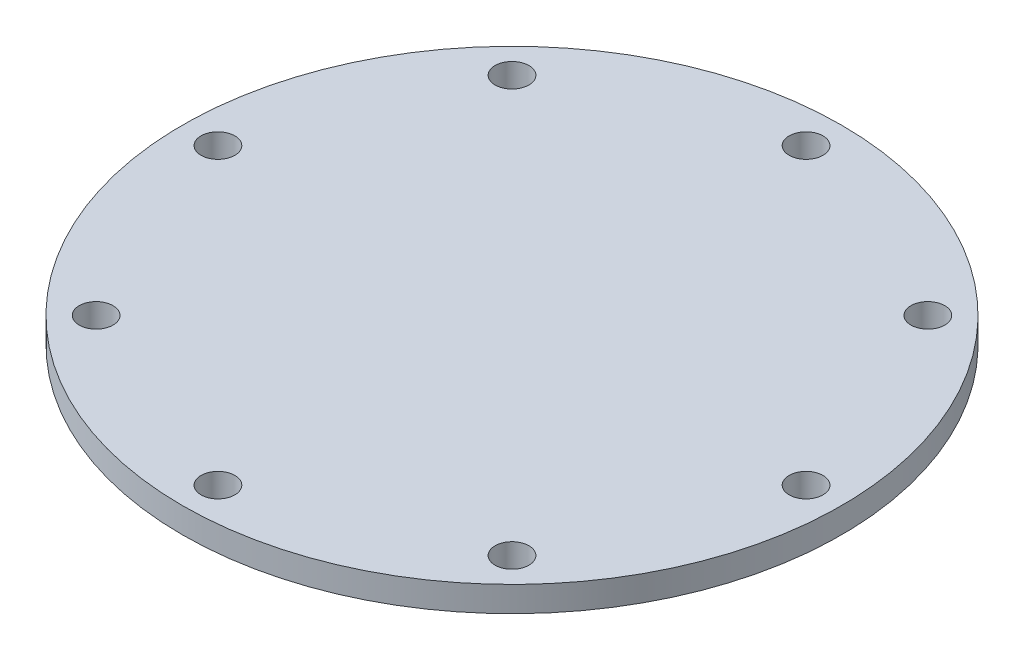
from build123d import *

# Parameters (mm, degrees)
SKETCH_1_R          = 195
EXTRUDE_1_DEPTH     = 15
CUT_EXTRUDE_1_REACH = 278.179
SKETCH_2_R          = 10


with BuildPart() as part:
    # 草图1 → 凸台-拉伸1 (new body)
    with BuildSketch(Plane(origin=(0, 0, 0), x_dir=(1, 0, 0), z_dir=(0, 1, 0))):
        with Locations(Location((0, 0, 0), (0, 0, 270))):
            Circle(SKETCH_1_R)
    extrude(amount=EXTRUDE_1_DEPTH)

    # 草图2 → 切除-拉伸1 (cut, up to next)
    with BuildSketch(Plane(origin=(0, 15, 0), x_dir=(1, 0, 0), z_dir=(0, 1, 0)), mode=Mode.PRIVATE) as cut_extrude_1_sk1:
        with Locations(Location((-174, 0, 0), (0, 0, 270))):
            Circle(SKETCH_2_R)
    cut_extrude_1_tool1 = extrude(cut_extrude_1_sk1.sketch, amount=-CUT_EXTRUDE_1_REACH, mode=Mode.PRIVATE) & part.part
    # 草图2 → 切除-拉伸1 (cut, up to next)
    with BuildSketch(Plane(origin=(0, 15, 0), x_dir=(1, 0, 0), z_dir=(0, 1, 0)), mode=Mode.PRIVATE) as cut_extrude_1_sk2:
        with Locations(Location((-123.036579926, 123.036579926, 0), (0, 0, 270))):
            Circle(SKETCH_2_R)
    cut_extrude_1_tool2 = extrude(cut_extrude_1_sk2.sketch, amount=-CUT_EXTRUDE_1_REACH, mode=Mode.PRIVATE) & part.part
    # 草图2 → 切除-拉伸1 (cut, up to next)
    with BuildSketch(Plane(origin=(0, 15, 0), x_dir=(1, 0, 0), z_dir=(0, 1, 0)), mode=Mode.PRIVATE) as cut_extrude_1_sk3:
        with Locations(Location((0, 174, 0), (0, 0, 270))):
            Circle(SKETCH_2_R)
    cut_extrude_1_tool3 = extrude(cut_extrude_1_sk3.sketch, amount=-CUT_EXTRUDE_1_REACH, mode=Mode.PRIVATE) & part.part
    # 草图2 → 切除-拉伸1 (cut, up to next)
    with BuildSketch(Plane(origin=(0, 15, 0), x_dir=(1, 0, 0), z_dir=(0, 1, 0)), mode=Mode.PRIVATE) as cut_extrude_1_sk4:
        with Locations(Location((123.036579926, 123.036579926, 0), (0, 0, 270))):
            Circle(SKETCH_2_R)
    cut_extrude_1_tool4 = extrude(cut_extrude_1_sk4.sketch, amount=-CUT_EXTRUDE_1_REACH, mode=Mode.PRIVATE) & part.part
    # 草图2 → 切除-拉伸1 (cut, up to next)
    with BuildSketch(Plane(origin=(0, 15, 0), x_dir=(1, 0, 0), z_dir=(0, 1, 0)), mode=Mode.PRIVATE) as cut_extrude_1_sk5:
        with Locations(Location((174, 0, 0), (0, 0, 270))):
            Circle(SKETCH_2_R)
    cut_extrude_1_tool5 = extrude(cut_extrude_1_sk5.sketch, amount=-CUT_EXTRUDE_1_REACH, mode=Mode.PRIVATE) & part.part
    # 草图2 → 切除-拉伸1 (cut, up to next)
    with BuildSketch(Plane(origin=(0, 15, 0), x_dir=(1, 0, 0), z_dir=(0, 1, 0)), mode=Mode.PRIVATE) as cut_extrude_1_sk6:
        with Locations(Location((123.036579926, -123.036579926, 0), (0, 0, 270))):
            Circle(SKETCH_2_R)
    cut_extrude_1_tool6 = extrude(cut_extrude_1_sk6.sketch, amount=-CUT_EXTRUDE_1_REACH, mode=Mode.PRIVATE) & part.part
    # 草图2 → 切除-拉伸1 (cut, up to next)
    with BuildSketch(Plane(origin=(0, 15, 0), x_dir=(1, 0, 0), z_dir=(0, 1, 0)), mode=Mode.PRIVATE) as cut_extrude_1_sk7:
        with Locations(Location((0, -174, 0), (0, 0, 270))):
            Circle(SKETCH_2_R)
    cut_extrude_1_tool7 = extrude(cut_extrude_1_sk7.sketch, amount=-CUT_EXTRUDE_1_REACH, mode=Mode.PRIVATE) & part.part
    # 草图2 → 切除-拉伸1 (cut, up to next)
    with BuildSketch(Plane(origin=(0, 15, 0), x_dir=(1, 0, 0), z_dir=(0, 1, 0)), mode=Mode.PRIVATE) as cut_extrude_1_sk8:
        with Locations(Location((-123.036579926, -123.036579926, 0), (0, 0, 270))):
            Circle(SKETCH_2_R)
    cut_extrude_1_tool8 = extrude(cut_extrude_1_sk8.sketch, amount=-CUT_EXTRUDE_1_REACH, mode=Mode.PRIVATE) & part.part
    add(cut_extrude_1_tool1.solids().sort_by_distance((-174, 15, 0))[0], mode=Mode.SUBTRACT)
    add(cut_extrude_1_tool2.solids().sort_by_distance((-123.03658, 15, -123.03658))[0], mode=Mode.SUBTRACT)
    add(cut_extrude_1_tool3.solids().sort_by_distance((0, 15, -174))[0], mode=Mode.SUBTRACT)
    add(cut_extrude_1_tool4.solids().sort_by_distance((123.03658, 15, -123.03658))[0], mode=Mode.SUBTRACT)
    add(cut_extrude_1_tool5.solids().sort_by_distance((174, 15, 0))[0], mode=Mode.SUBTRACT)
    add(cut_extrude_1_tool6.solids().sort_by_distance((123.03658, 15, 123.03658))[0], mode=Mode.SUBTRACT)
    add(cut_extrude_1_tool7.solids().sort_by_distance((0, 15, 174))[0], mode=Mode.SUBTRACT)
    add(cut_extrude_1_tool8.solids().sort_by_distance((-123.03658, 15, 123.03658))[0], mode=Mode.SUBTRACT)


solid = part.part
